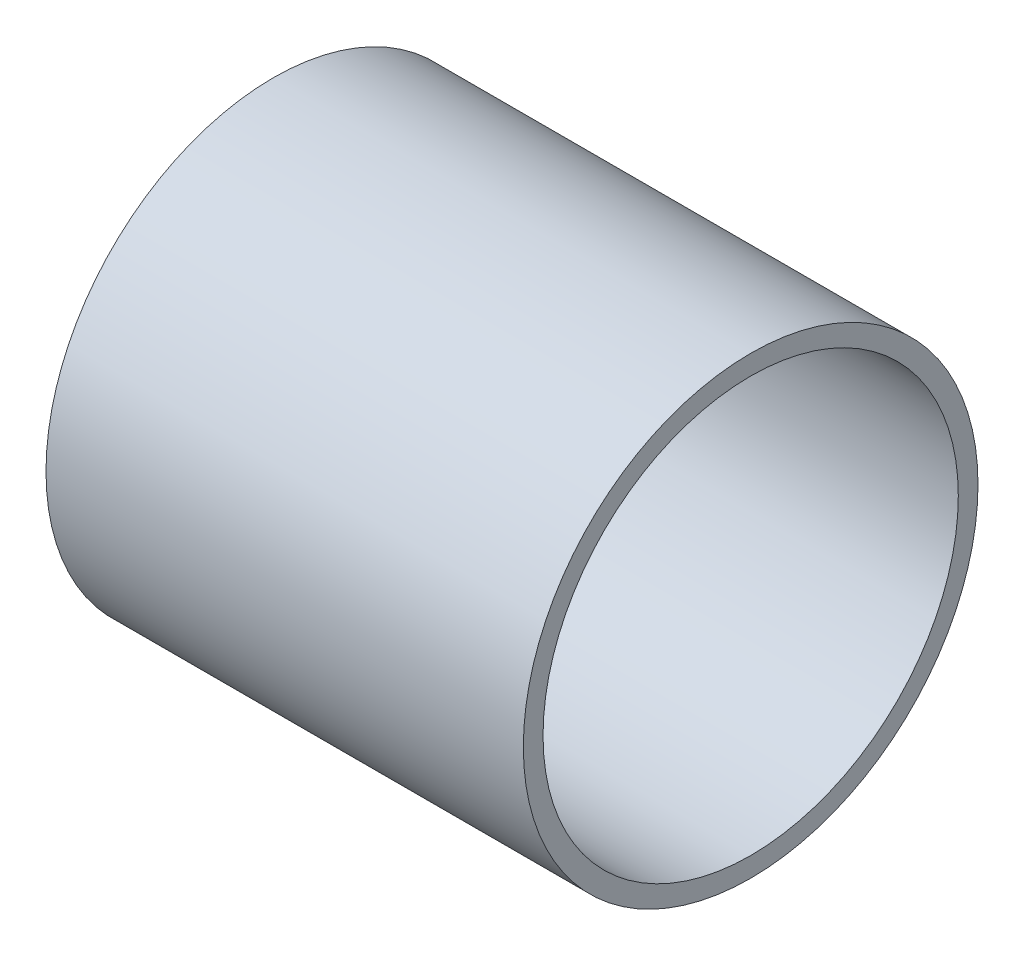
from build123d import *

# Parameters (mm, degrees)
CROQUIS1_R              = 19.05
SALIENTE_EXTRUIR1_DEPTH = 20
CROQUIS2_R              = 17.4
CORTAR_EXTRUIR1_DEPTH   = 197


with BuildPart() as part:
    # Croquis1 → Saliente-Extruir1 (new, symmetric)
    with BuildSketch(Plane(origin=(0, 0, 0), x_dir=(0, 0, -1), z_dir=(1, 0, 0))):
        Circle(CROQUIS1_R)
    extrude(amount=SALIENTE_EXTRUIR1_DEPTH, both=True)

    # Croquis2 → Cortar-Extruir1 (cut)
    with BuildSketch(Plane.ZY.offset(20)):
        Circle(CROQUIS2_R)
    extrude(amount=-CORTAR_EXTRUIR1_DEPTH, mode=Mode.SUBTRACT)


solid = part.part
